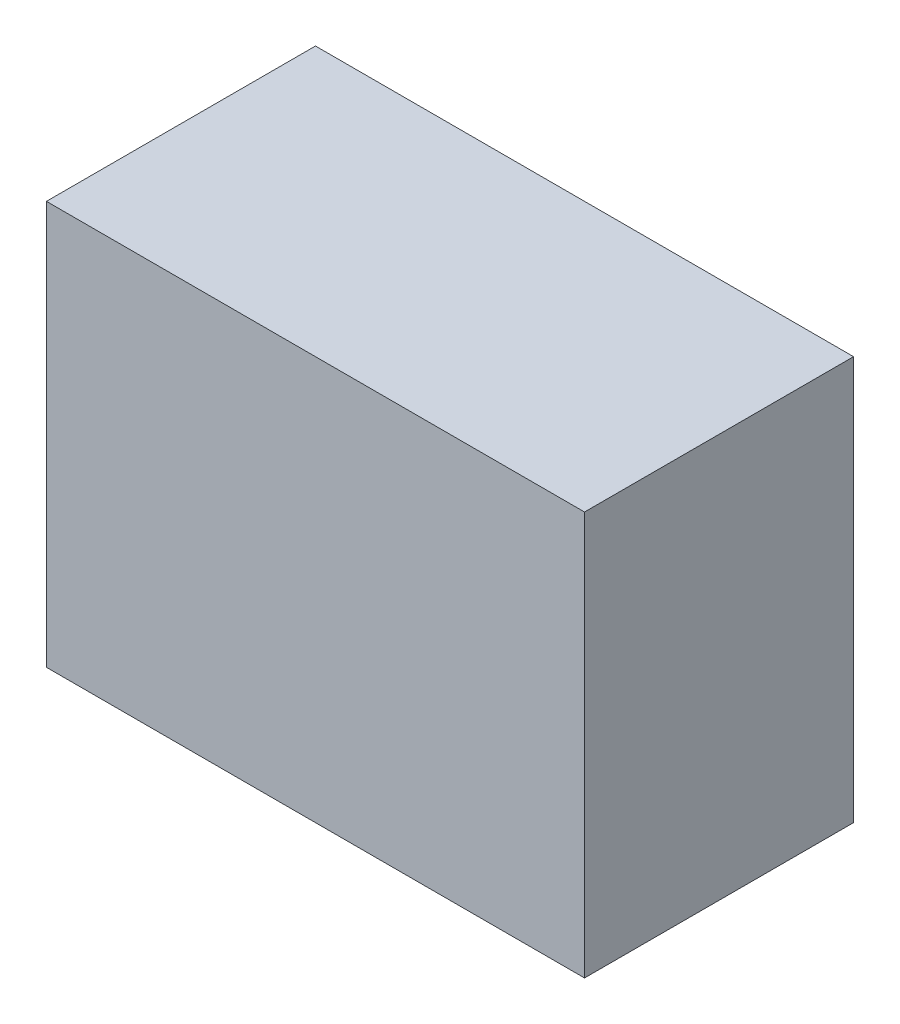
from build123d import *

# Parameters (mm, degrees)
SKETCH1_W           = 20
SKETCH1_H           = 15
BOSS_EXTRUDE1_DEPTH = 10


with BuildPart() as part:
    # Sketch1 → Boss-Extrude1 (new body)
    with BuildSketch(Plane.XY):
        Rectangle(SKETCH1_W, SKETCH1_H)
    extrude(amount=BOSS_EXTRUDE1_DEPTH)


solid = part.part
